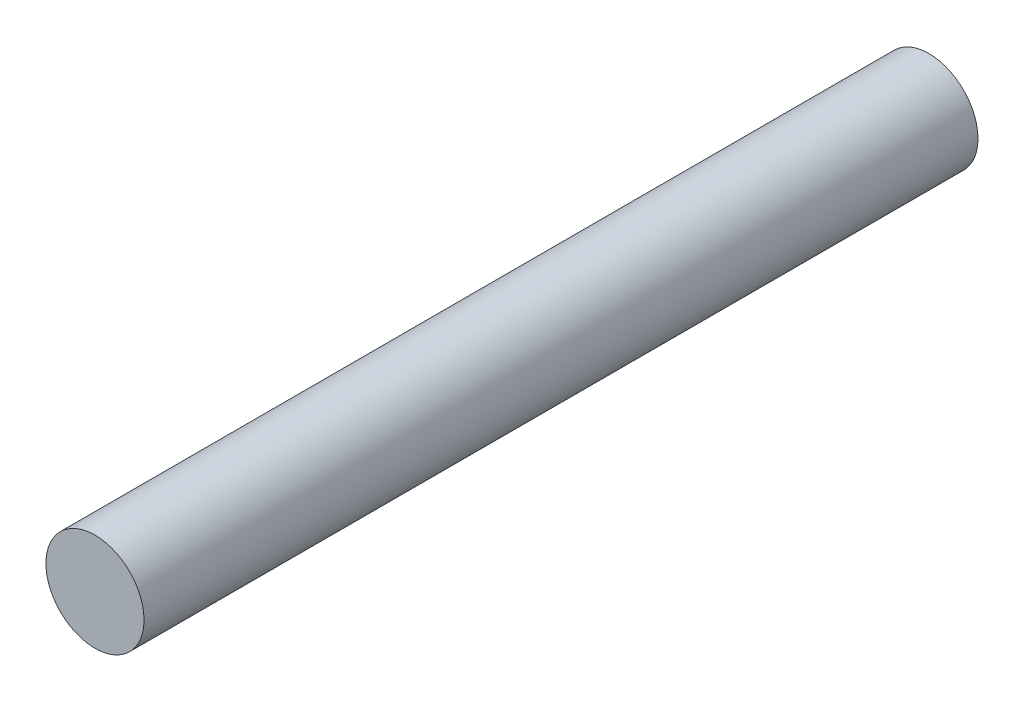
from build123d import *

# Parameters (mm, degrees)
SKETCH1_R           = 4
BOSS_EXTRUDE1_DEPTH = 34


with BuildPart() as part:
    # Sketch1 → Boss-Extrude1 (new, symmetric)
    with BuildSketch(Plane.XY):
        Circle(SKETCH1_R)
    extrude(amount=BOSS_EXTRUDE1_DEPTH, both=True)


solid = part.part
